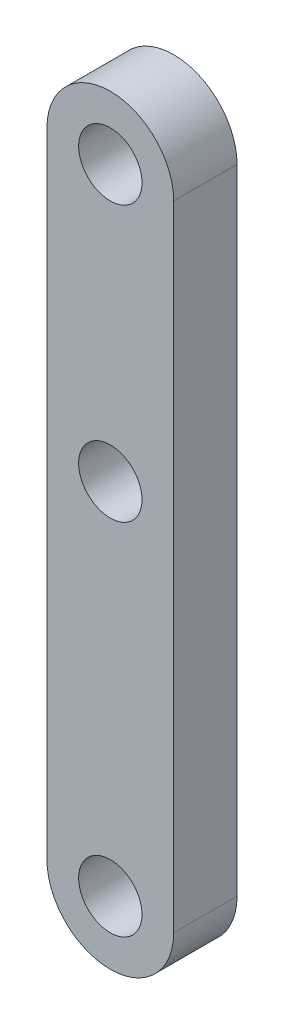
from build123d import *

# Parameters (mm, degrees)
SKETCH_1_R      = 1.5
EXTRUDE_1_DEPTH = 3


with BuildPart() as part:
    # ｽｹｯﾁ1 → ﾎﾞｽ - 押し出し1 (new body)
    with BuildSketch(Plane.XY):
        with BuildLine():
            Line((-3, 0), (-3, -30))
            ThreePointArc((-3, -30), (0, -33), (3, -30))
            Line((3, -30), (3, 0))
            ThreePointArc((3, 0), (0, 3), (-3, 0))
        make_face()
        Circle(SKETCH_1_R, mode=Mode.SUBTRACT)
        with Locations(Location((0, -30, 0), (0, 0, 180))):
            Circle(SKETCH_1_R, mode=Mode.SUBTRACT)
        with Locations((0, -13)):
            Circle(SKETCH_1_R, mode=Mode.SUBTRACT)
    extrude(amount=EXTRUDE_1_DEPTH)


solid = part.part
